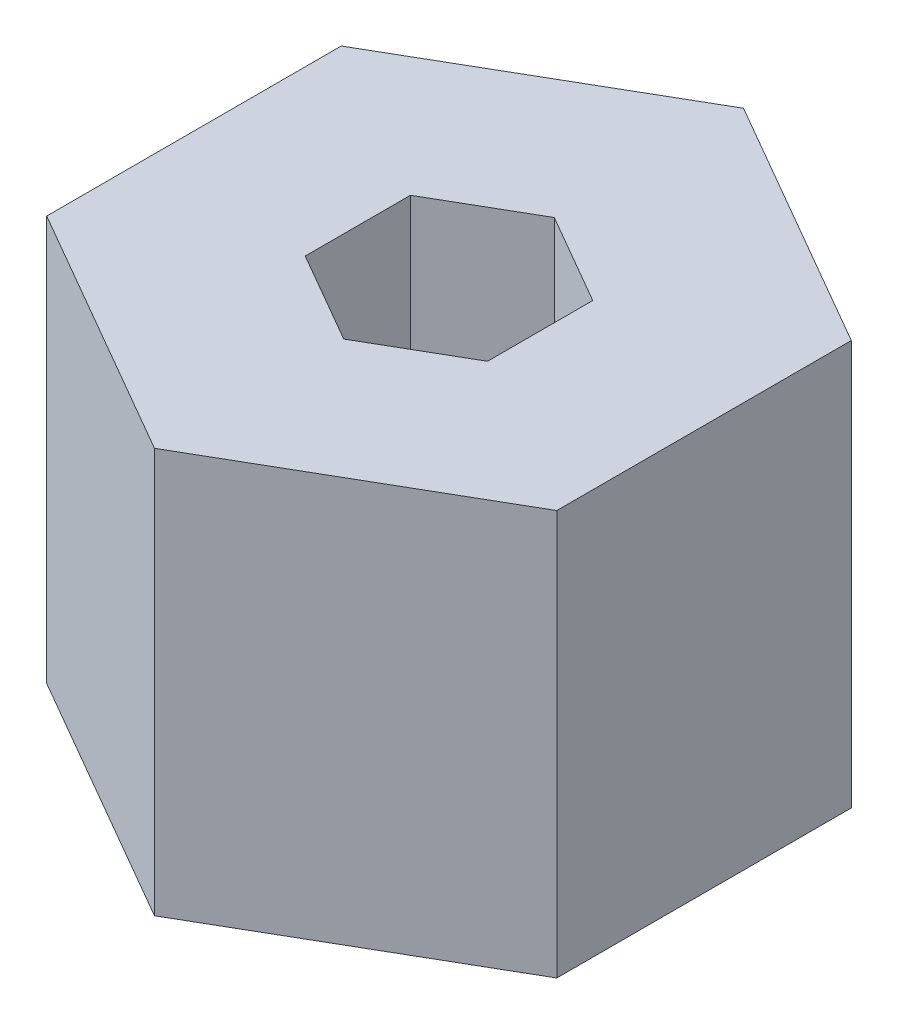
from build123d import *

# Parameters (mm, degrees)
BOSS_EXTRUDE1_DEPTH = 10


with BuildPart() as part:
    # Sketch1 → Boss-Extrude1 (new body)
    with BuildSketch(Plane(origin=(0, 0, 0), x_dir=(1, 0, 0), z_dir=(0, 1, 0))):
        Polygon((0, 7.274613392), (-6.3, 3.637306696), (-6.3, -3.637306696), (0, -7.274613392), (6.3, -3.637306696), (6.3, 3.637306696), align=None)
        Polygon((0, 2.6), (-2.25166605, 1.3), (-2.25166605, -1.3), (0, -2.6), (2.25166605, -1.3), (2.25166605, 1.3), align=None, mode=Mode.SUBTRACT)
    extrude(amount=BOSS_EXTRUDE1_DEPTH)


solid = part.part
